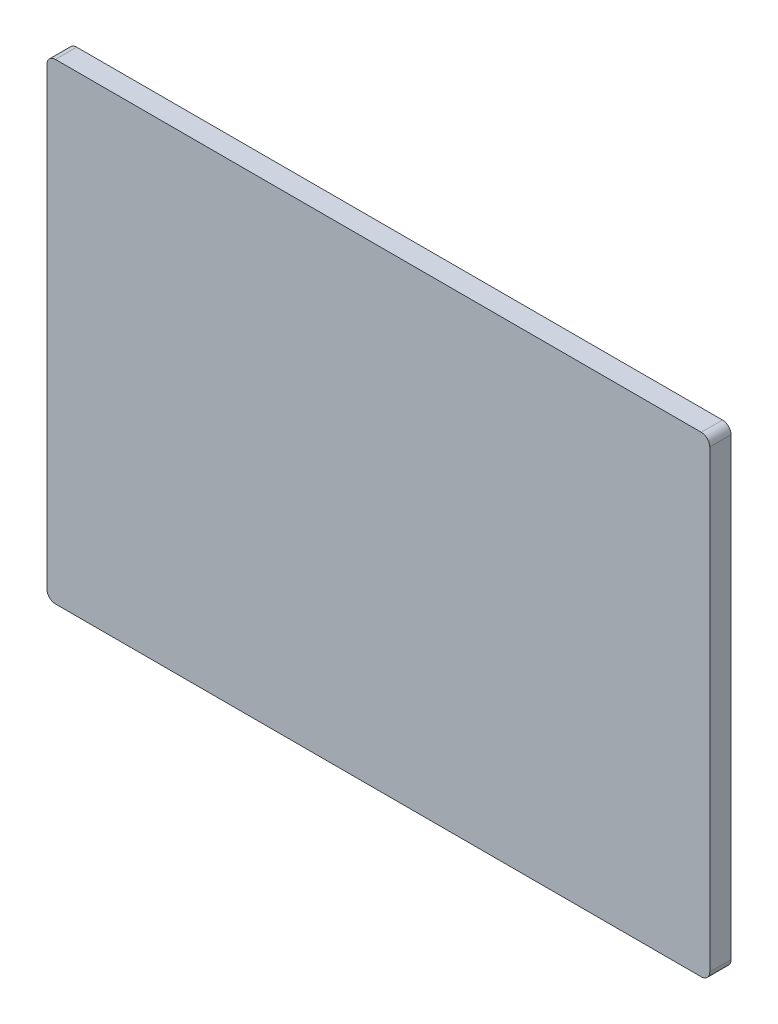
from build123d import *

# Parameters (mm, degrees)
SKETCH2_W           = 156
SKETCH2_H           = 111
BOSS_EXTRUDE1_DEPTH = 5
FILLET1_R           = 2


with BuildPart() as part:
    # Sketch2 → Boss-Extrude1 (new body)
    with BuildSketch(Plane.XY):
        Rectangle(SKETCH2_W, SKETCH2_H)
    extrude(amount=BOSS_EXTRUDE1_DEPTH)

    # Fillet1
    fillet1_edges = [part.edges().sort_by_distance(p)[0] for p in [
        (-78, 55.5, 2.5),
        (78, 55.5, 2.5),
        (78, -55.5, 2.5),
        (-78, -55.5, 2.5),
    ]]
    fillet(fillet1_edges, radius=FILLET1_R)


solid = part.part
